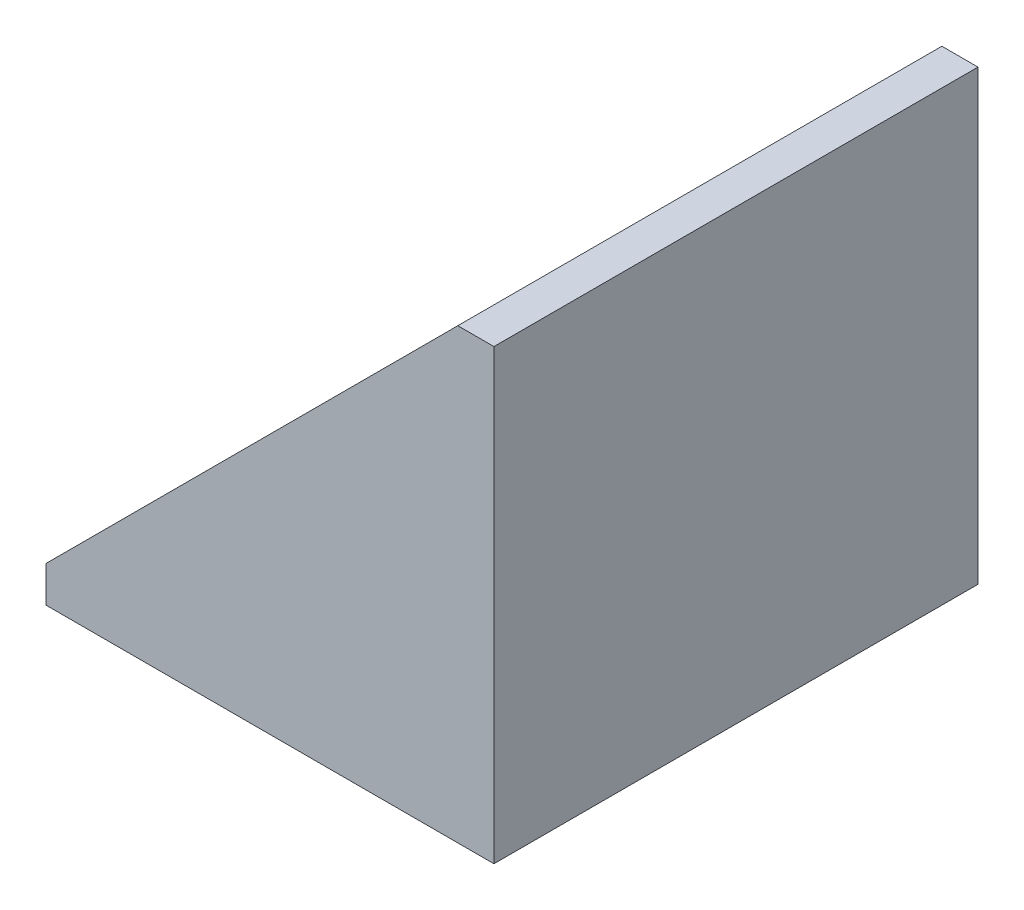
from build123d import *

# Parameters (mm, degrees)
SKETCH1_W           = 57
SKETCH1_H           = 57
SKETCH1_R           = 2.5
SKETCH1_R_2         = 19.2
BOSS_EXTRUDE1_DEPTH = 5
SKETCH2_W           = 5
SKETCH2_H           = 62
BOSS_EXTRUDE2_DEPTH = 57
BOSS_EXTRUDE3_DEPTH = 5
BOSS_EXTRUDE4_START = -57
BOSS_EXTRUDE4_DEPTH = 5


with BuildPart() as part:
    # Sketch1 → Boss-Extrude1 (new body)
    with BuildSketch(Plane(origin=(0, 0, 0), x_dir=(1, 0, 0), z_dir=(0, 1, 0))):
        Rectangle(SKETCH1_W, SKETCH1_H)
        with Locations(Location((-23.55, 23.55, 0), (0, 0, 270))):
            Circle(SKETCH1_R, mode=Mode.SUBTRACT)
        with Locations(Location((23.55, 23.55, 0), (0, 0, 270))):
            Circle(SKETCH1_R, mode=Mode.SUBTRACT)
        with Locations(Location((23.55, -23.55, 0), (0, 0, 270))):
            Circle(SKETCH1_R, mode=Mode.SUBTRACT)
        with Locations(Location((-23.55, -23.55, 0), (0, 0, 270))):
            Circle(SKETCH1_R, mode=Mode.SUBTRACT)
        with Locations(Location((0, 0, 0), (0, 0, 270))):
            Circle(SKETCH1_R_2, mode=Mode.SUBTRACT)
    extrude(amount=BOSS_EXTRUDE1_DEPTH)

    # Sketch2 → Boss-Extrude2 (add)
    with BuildSketch(Plane.XY.offset(28.5)):
        with Locations((31, 31)):
            Rectangle(SKETCH2_W, SKETCH2_H)
    extrude(amount=-BOSS_EXTRUDE2_DEPTH)

    # Sketch3 → Boss-Extrude3 (add)
    with BuildSketch(Plane.XY.offset(28.5)):
        Polygon((28.5, 62), (-28.5, 5), (-28.5, 0), (33.5, 0), (33.5, 62), align=None)
    extrude(amount=BOSS_EXTRUDE3_DEPTH)

    # Sketch3<2> → Boss-Extrude4 (add)
    with BuildSketch(Plane.XY.offset(28.5).offset(BOSS_EXTRUDE4_START)):
        Polygon((28.5, 62), (-28.5, 5), (-28.5, 0), (33.5, 0), (33.5, 62), align=None)
    extrude(amount=-BOSS_EXTRUDE4_DEPTH)


solid = part.part
